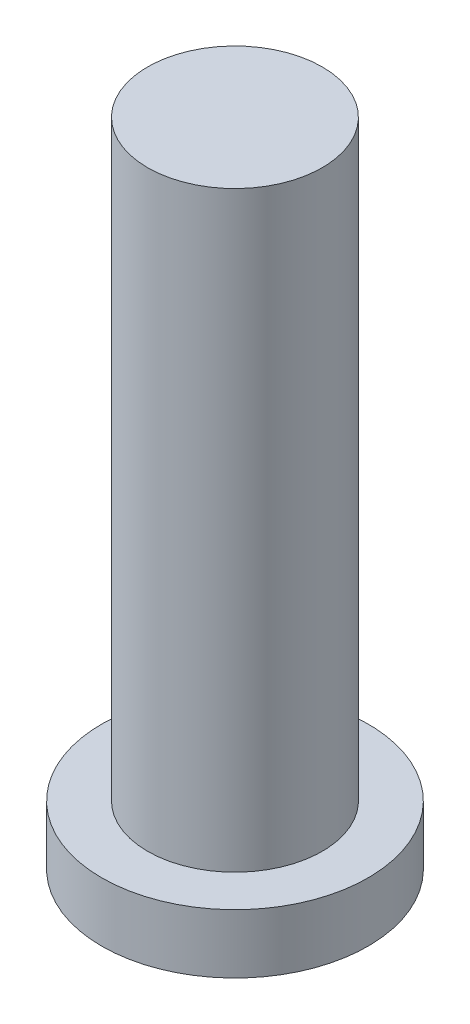
from build123d import *

# Parameters (mm, degrees)
SKETCH1_R           = 4.5
BOSS_EXTRUDE1_DEPTH = 2
SKETCH2_R           = 2.95
BOSS_EXTRUDE4_DEPTH = 20


with BuildPart() as part:
    # Sketch1 → Boss-Extrude1 (new body)
    with BuildSketch(Plane(origin=(0, 0, 0), x_dir=(1, 0, 0), z_dir=(0, 1, 0))):
        with Locations(Location((0, 0, 0), (0, 0, 270))):
            Circle(SKETCH1_R)
    extrude(amount=BOSS_EXTRUDE1_DEPTH)

    # Sketch2 → Boss-Extrude4 (add)
    with BuildSketch(Plane(origin=(0, 2, 0), x_dir=(1, 0, 0), z_dir=(0, 1, 0))):
        with Locations(Location((0, 0, 0), (0, 0, 270))):
            Circle(SKETCH2_R)
    extrude(amount=BOSS_EXTRUDE4_DEPTH)


solid = part.part
